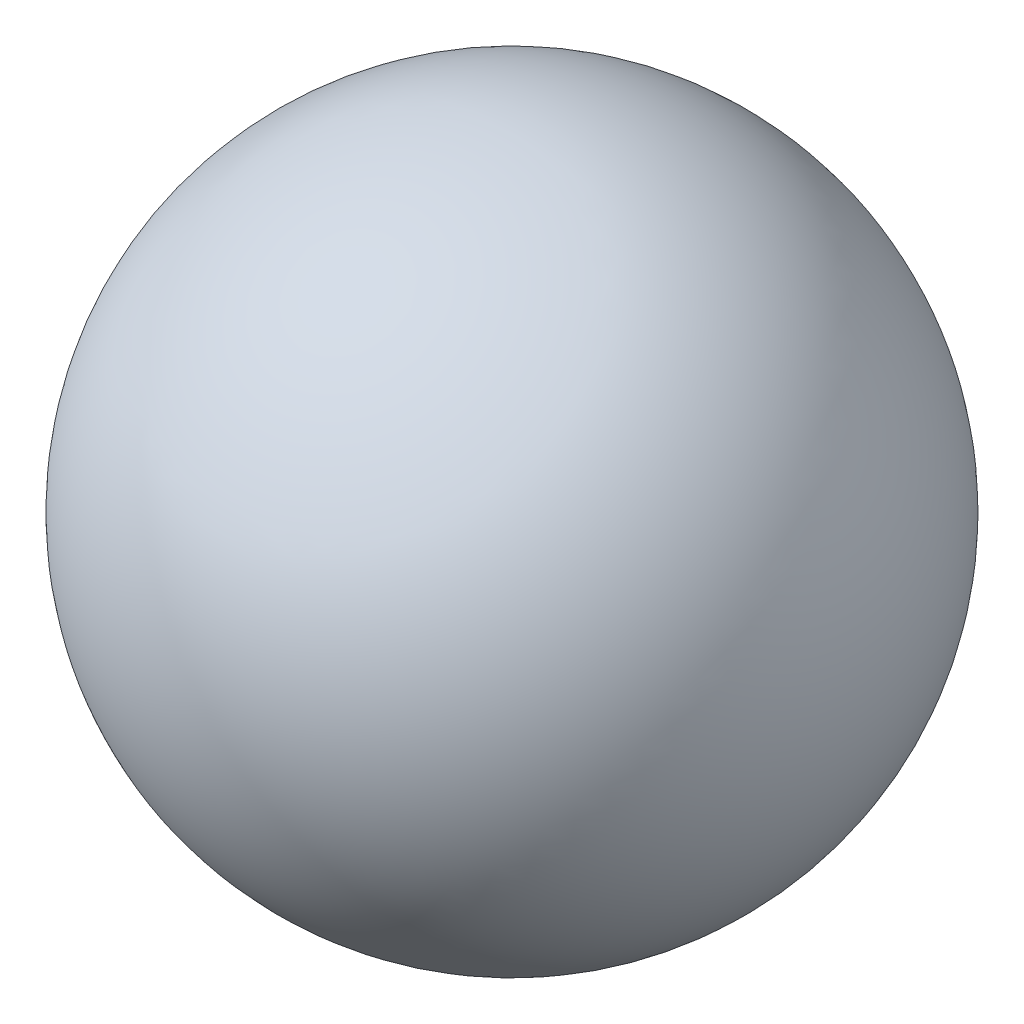
from build123d import *

# Parameters (mm, degrees)
M3X0_5_TAPPED_HOLE1_D     = 2.5
M3X0_5_TAPPED_HOLE1_DEPTH = 5
M3X0_5_TAPPED_HOLE1_TIP   = 0.751075774


with BuildPart() as part:
    # Sketch2 → Revolve1 (revolve)
    with BuildSketch(Plane(origin=(0, 0, 0), x_dir=(1, 0, 0), z_dir=(0, 1, 0)), mode=Mode.PRIVATE) as revolve1_sk:
        with BuildLine():
            Line((1.936491673, 7.5), (0, 7.5))
            Line((0, 7.5), (0, 0))
            ThreePointArc((0, 0), (3.872983346, 3), (1.936491673, 7.5))
        make_face()
    revolve(revolve1_sk.sketch.rotate(Axis((0, 0, -7.5), (0, 0, 1)), 180), axis=Axis((0, 0, -7.5), (0, 0, 1)))

    # M3x0.5 Tapped Hole1
    with Locations(Plane(origin=(0, 0, -7.5), x_dir=(-1, 0, 0), z_dir=(0, 0, -1))):
        with Locations((0, 0)):
            Hole(M3X0_5_TAPPED_HOLE1_D / 2, depth=M3X0_5_TAPPED_HOLE1_DEPTH)
            with Locations((0, 0, -(M3X0_5_TAPPED_HOLE1_DEPTH + M3X0_5_TAPPED_HOLE1_TIP / 2))):  # 118° drill point
                Cone(0, M3X0_5_TAPPED_HOLE1_D / 2, M3X0_5_TAPPED_HOLE1_TIP, mode=Mode.SUBTRACT)


solid = part.part
